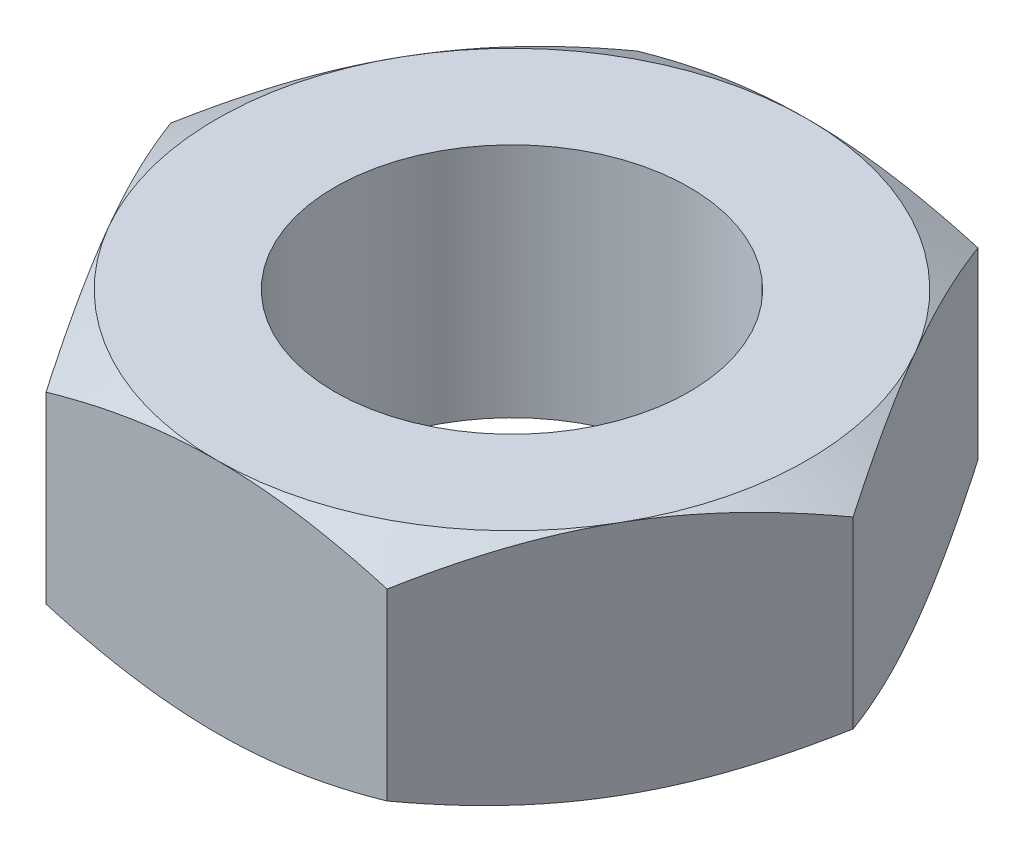
from build123d import *

# Parameters (mm, degrees)
SKETCH3_R               = 15
BOSS_EXTRUDE1_DEPTH     = 10
SKETCH4_OUTSIDE_W       = 144.808
SKETCH4_OUTSIDE_H       = 137.072
SKETCH4_OUTSIDE_R       = 25
CUT_EXTRUDE1_DEPTH      = 20
CUT_EXTRUDE1_DRAFT      = -60
MIRROR1_COPY_1_SKETCH_W = 144.808
MIRROR1_COPY_1_SKETCH_H = 137.072
MIRROR1_COPY_1_SKETCH_R = 25
MIRROR1_COPY_1_DEPTH    = 20
MIRROR1_COPY_1_DRAFT    = -60


with BuildPart() as part:
    # Sketch3 → Boss-Extrude1 (new, symmetric)
    with BuildSketch(Plane(origin=(0, 0, 0), x_dir=(1, 0, 0), z_dir=(0, 1, 0))):
        Polygon((28.867513459, 0), (14.43375673, 25), (-14.43375673, 25), (-28.867513459, 0), (-14.43375673, -25), (14.43375673, -25), align=None)
        with Locations(Location((0, 0, 0), (0, 0, 270))):
            Circle(SKETCH3_R, mode=Mode.SUBTRACT)
    extrude(amount=BOSS_EXTRUDE1_DEPTH, both=True)


with BuildPart() as cut_extrude1_tool:
    # Sketch4 outside → Cut-Extrude1 (with draft: the straight prism first)
    with BuildSketch(Plane.XZ.offset(10)):
        Rectangle(SKETCH4_OUTSIDE_W, SKETCH4_OUTSIDE_H)
        Circle(SKETCH4_OUTSIDE_R, mode=Mode.SUBTRACT)
    extrude(amount=-CUT_EXTRUDE1_DEPTH)
    # Cut-Extrude1: the draft: its side faces are tilted about the plane it starts from
    cut_extrude1_sides = [cut_extrude1_tool.faces().sort_by_distance(p)[0] for p in [
        (0, 0, -68.536),
        (72.404, 0, 0),
        (0, 0, 68.536),
        (-72.404, 0, 0),
        (-25, 0, 0),
    ]]
    draft(cut_extrude1_sides, Plane.XZ.offset(10), CUT_EXTRUDE1_DRAFT)


with BuildPart() as part_1:
    add(part.part)

    # Cut-Extrude1: cut by cut_extrude1_tool
    add(cut_extrude1_tool.part, mode=Mode.SUBTRACT)


with BuildPart() as mirror1_copy_1_tool:
    # Mirror1 copy 1 sketch → Mirror1 copy 1 (with draft: the straight prism first)
    with BuildSketch(Plane(origin=(0, 10, 0), x_dir=(1, 0, 0), z_dir=(0, 1, 0))):
        Rectangle(MIRROR1_COPY_1_SKETCH_W, MIRROR1_COPY_1_SKETCH_H)
        Circle(MIRROR1_COPY_1_SKETCH_R, mode=Mode.SUBTRACT)
    extrude(amount=-MIRROR1_COPY_1_DEPTH)
    # Mirror1 copy 1: the draft: its side faces are tilted about the plane it starts from
    mirror1_copy_1_sides = [mirror1_copy_1_tool.faces().sort_by_distance(p)[0] for p in [
        (0, 0, -68.536),
        (72.404, 0, 0),
        (0, 0, 68.536),
        (-72.404, 0, 0),
        (-25, 0, 0),
    ]]
    draft(mirror1_copy_1_sides, Plane(origin=(0, 10, 0), x_dir=(1, 0, 0), z_dir=(0, 1, 0)), MIRROR1_COPY_1_DRAFT)


with BuildPart() as part_2:
    add(part_1.part)

    # Mirror1 copy 1: cut by mirror1_copy_1_tool
    add(mirror1_copy_1_tool.part, mode=Mode.SUBTRACT)


solid = part_2.part
